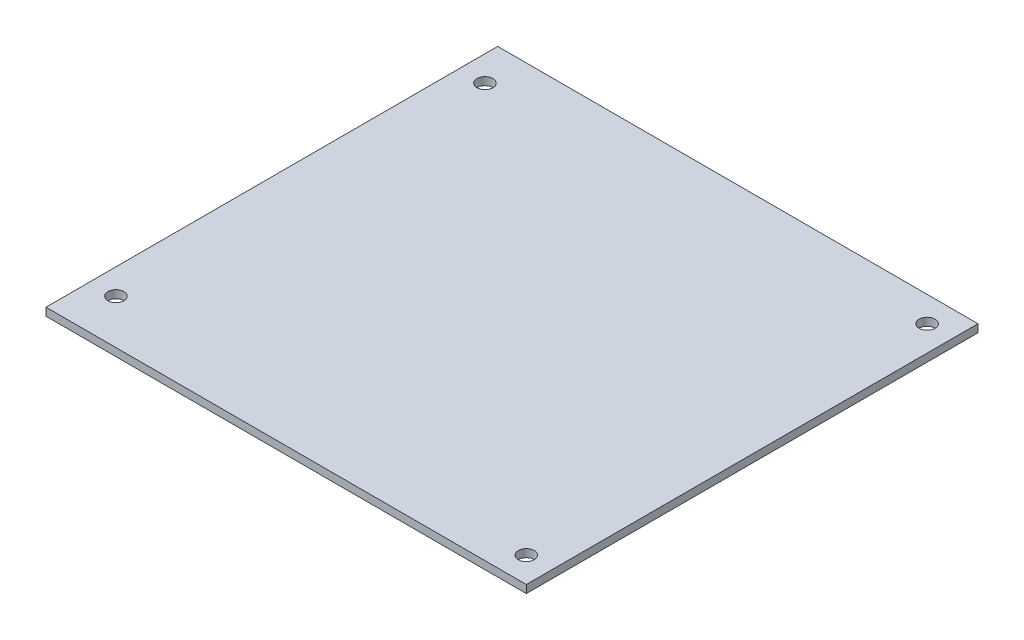
from build123d import *

# Parameters (mm, degrees)
SKETCH1_W           = 95.89
SKETCH1_H           = 90.17
BOSS_EXTRUDE1_DEPTH = 1.57
SKETCH2_R           = 1.59
CUT_EXTRUDE1_DEPTH  = 66.831946272


with BuildPart() as part:
    # Sketch1 → Boss-Extrude1 (new body)
    with BuildSketch(Plane(origin=(0, 0, 0), x_dir=(1, 0, 0), z_dir=(0, 1, 0))):
        Rectangle(SKETCH1_W, SKETCH1_H)
    extrude(amount=BOSS_EXTRUDE1_DEPTH)

    # Sketch2 → Cut-Extrude1 (cut, through all)
    with BuildSketch(Plane(origin=(0, 1.57, 0), x_dir=(1, 0, 0), z_dir=(0, 1, 0))):
        with Locations(Location((42.865, -40.005, 0), (0, 0, 270))):
            Circle(SKETCH2_R)
        with Locations(Location((-42.865, -36.195, 0), (0, 0, 270))):
            Circle(SKETCH2_R)
        with Locations(Location((-42.865, 37.465, 0), (0, 0, 270))):
            Circle(SKETCH2_R)
        with Locations(Location((42.865, 40.005, 0), (0, 0, 270))):
            Circle(SKETCH2_R)
    extrude(amount=-CUT_EXTRUDE1_DEPTH, mode=Mode.SUBTRACT)


solid = part.part
